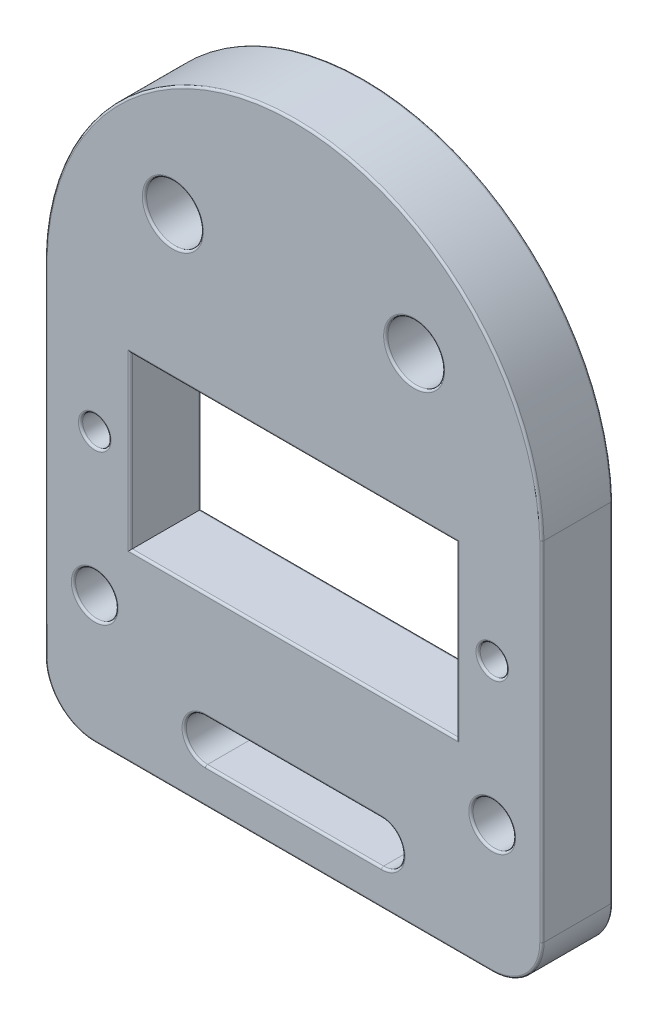
from build123d import *

# Parameters (mm, degrees)
SKETCH_1_R      = 1.5
SKETCH_1_R_2    = 1
SKETCH_1_W      = 23
SKETCH_1_H      = 12
SKETCH_1_R_3    = 2
EXTRUDE_1_DEPTH = 5
FILLET_1_R      = 3.5
FILLET_2_R      = 0.15


with BuildPart() as part:
    # 草图1 → 凸台-拉伸1 (new body)
    with BuildSketch(Plane.XY):
        with BuildLine():
            Line((-17.5, -19), (0, -19))
            Line((0, -19), (17.5, -19))
            Line((17.5, -19), (17.5, 9))
            ThreePointArc((17.5, 9), (0, 26), (-17.5, 9))
            Line((-17.5, 9), (-17.5, -19))
        make_face()
        with Locations((-14, -10)):
            Circle(SKETCH_1_R, mode=Mode.SUBTRACT)
        with Locations((-14, 0)):
            Circle(SKETCH_1_R_2, mode=Mode.SUBTRACT)
        with BuildLine():
            ThreePointArc((-6.2, -16.5), (-7.7, -15), (-6.2, -13.5))
            Line((-6.2, -13.5), (6.2, -13.5))
            ThreePointArc((6.2, -13.5), (7.7, -15), (6.2, -16.5))
            Line((6.2, -16.5), (-6.2, -16.5))
        make_face(mode=Mode.SUBTRACT)
        with Locations((14, -10)):
            Circle(SKETCH_1_R, mode=Mode.SUBTRACT)
        Rectangle(SKETCH_1_W, SKETCH_1_H, mode=Mode.SUBTRACT)
        with Locations((14, 0)):
            Circle(SKETCH_1_R_2, mode=Mode.SUBTRACT)
        with Locations((-8.5, 16)):
            Circle(SKETCH_1_R_3, mode=Mode.SUBTRACT)
        with Locations((8.5, 16)):
            Circle(SKETCH_1_R_3, mode=Mode.SUBTRACT)
    extrude(amount=EXTRUDE_1_DEPTH)

    # 圆角1
    fillet_1_edges = [part.edges().sort_by_distance(p)[0] for p in [
        (17.5, -19, 2.5),
        (-17.5, -19, 2.5),
    ]]
    fillet(fillet_1_edges, radius=FILLET_1_R)

    # 圆角2
    fillet_2_edges = [part.edges().sort_by_distance(p)[0] for p in [
        (6.5, 16, 5),
        (0, 26, 5),
        (-17.5, -3.25, 5),
        (6.5, 16, 0),
        (12.5, -10, 0),
        (-10.5, 16, 0),
        (0, -13.5, 0),
        (-7.7, -15, 0),
        (0, -16.5, 0),
        (7.7, -15, 0),
        (-15.5, -10, 0),
        (-15, 0, 0),
        (0, 6, 0),
        (-11.5, 0, 0),
        (0, -6, 0),
        (11.5, 0, 0),
        (13, 0, 0),
        (17.5, -3.25, 0),
        (17.5, -3.25, 5),
        (-17.5, -3.25, 0),
        (0, 26, 0),
        (13, 0, 5),
        (11.5, 0, 5),
        (0, -6, 5),
        (-11.5, 0, 5),
        (0, 6, 5),
        (0, -19, 0),
        (0, -19, 5),
        (16.474873734, -17.974873734, 0),
        (-16.474873734, -17.974873734, 0),
        (-15, 0, 5),
        (16.474873734, -17.974873734, 5),
        (-16.474873734, -17.974873734, 5),
        (-15.5, -10, 5),
        (7.7, -15, 5),
        (0, -16.5, 5),
        (-7.7, -15, 5),
        (0, -13.5, 5),
        (-10.5, 16, 5),
        (12.5, -10, 5),
    ]]
    fillet(fillet_2_edges, radius=FILLET_2_R)


solid = part.part
